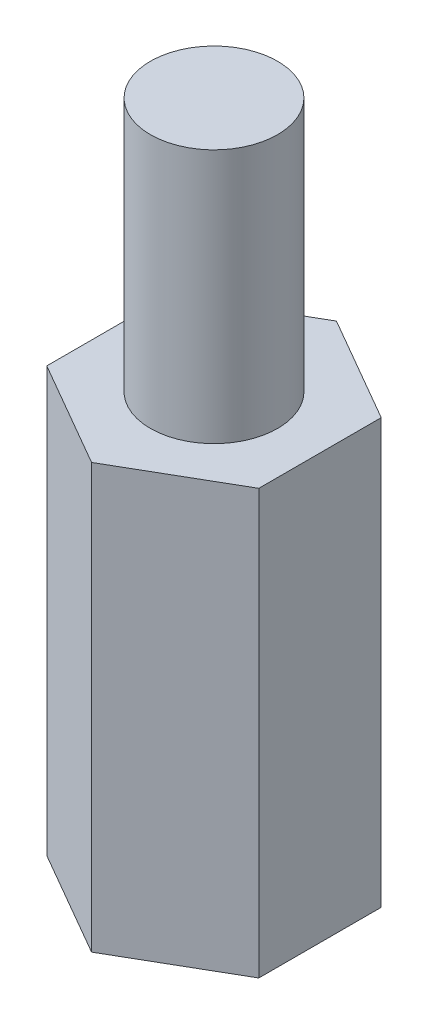
from build123d import *

# Parameters (mm, degrees)
BOSS_EXTRUDE1_DEPTH = 10
SKETCH2_R           = 1.5
BOSS_EXTRUDE2_DEPTH = 6
SKETCH3_R           = 1.35
CUT_EXTRUDE1_DEPTH  = 6


with BuildPart() as part:
    # Sketch1 → Boss-Extrude1 (new body)
    with BuildSketch(Plane(origin=(0, 0, 0), x_dir=(1, 0, 0), z_dir=(0, 1, 0))):
        Polygon((2.5, -1.443375673), (2.5, 1.443375673), (0, 2.886751346), (-2.5, 1.443375673), (-2.5, -1.443375673), (0, -2.886751346), align=None)
    extrude(amount=BOSS_EXTRUDE1_DEPTH)

    # Sketch2 → Boss-Extrude2 (add)
    with BuildSketch(Plane(origin=(0, 10, 0), x_dir=(1, 0, 0), z_dir=(0, 1, 0))):
        with Locations(Location((0, 0, 0), (0, 0, 270))):
            Circle(SKETCH2_R)
    extrude(amount=BOSS_EXTRUDE2_DEPTH)

    # Sketch3 → Cut-Extrude1 (cut)
    with BuildSketch(Plane.XZ):
        with Locations(Location((0, 0, 0), (0, 0, 270))):
            Circle(SKETCH3_R)
    extrude(amount=-CUT_EXTRUDE1_DEPTH, mode=Mode.SUBTRACT)


solid = part.part
